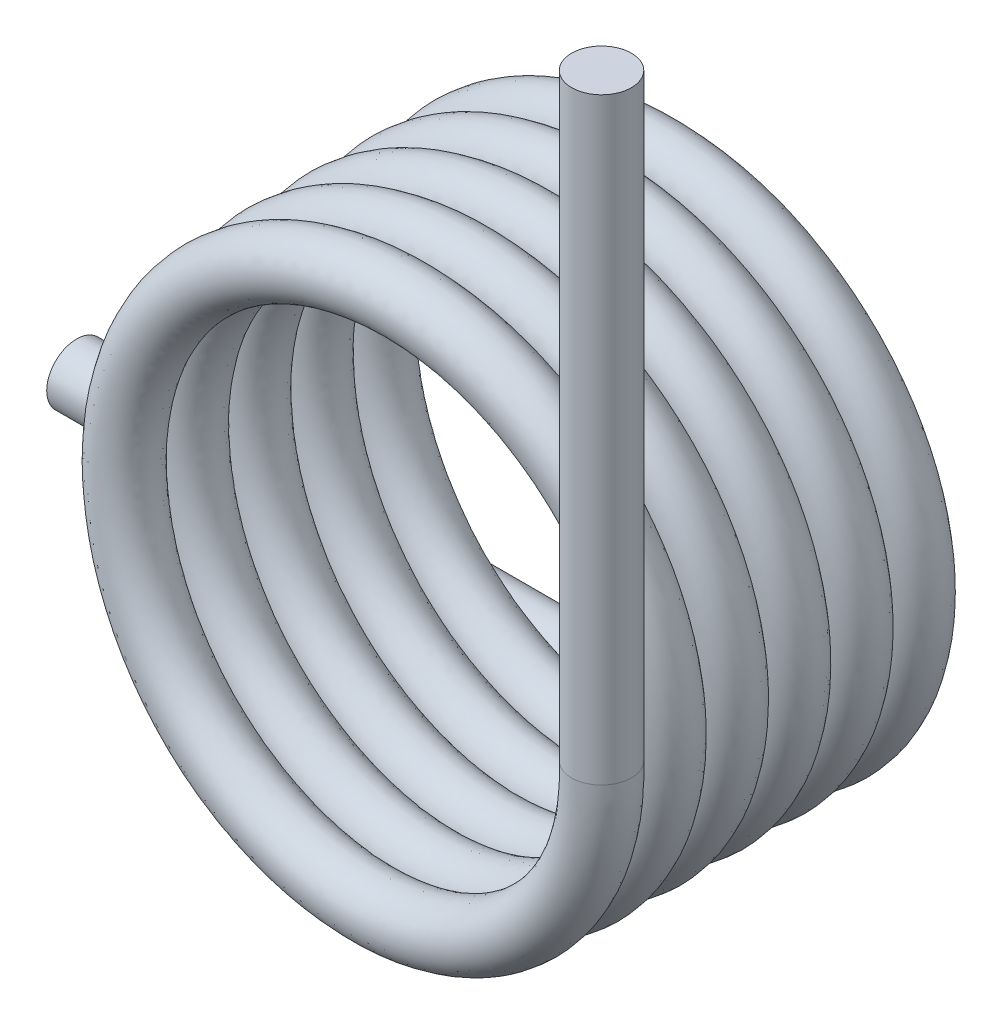
from build123d import *

# Parameters (mm, degrees)
SWEEP1_PITCH        = 0.625
SWEEP1_HEIGHT       = 3.28125
SWEEP1_RADIUS       = 2.55
SWEEP1_START_ANGLE  = 180
SKETCH2_R           = 0.3
SKETCH4_R           = 0.3
BOSS_EXTRUDE1_DEPTH = 6
SKETCH5_R           = 0.3
BOSS_EXTRUDE2_DEPTH = 6


with BuildPart() as part:
    # Sweep1: sweep along a helix
    with BuildLine() as sweep1_path:
        add(Helix(SWEEP1_PITCH, SWEEP1_HEIGHT, SWEEP1_RADIUS, center=(0, 0, 0), direction=(0, 0, -1), mode=Mode.PRIVATE).rotate(Axis((0, 0, 0), (0, 0, -1)), SWEEP1_START_ANGLE))
    # Sketch2 → Sweep1 (sweep)
    with BuildSketch(Plane(origin=(0, 0, 0), x_dir=(1, 0, 0), z_dir=(0, 1, 0))):
        with Locations((2.55, 0)):
            Circle(SKETCH2_R)
    sweep(path=sweep1_path.line, is_frenet=True)

    # Sketch4 → Boss-Extrude1 (add)
    with BuildSketch(Plane(origin=(0, 0, 0), x_dir=(0, -1, 0), z_dir=(-1, 0, 0))):
        with Locations(Location((2.55, -3.28125, 0), (0, 0, 90))):
            Circle(SKETCH4_R)
    extrude(amount=BOSS_EXTRUDE1_DEPTH)

    # Sketch5 → Boss-Extrude2 (add)
    with BuildSketch(Plane(origin=(0, 0, 0), x_dir=(1, 0, 0), z_dir=(0, 1, 0))):
        with Locations(Location((2.55, 0, 0), (0, 0, 270))):
            Circle(SKETCH5_R)
    extrude(amount=BOSS_EXTRUDE2_DEPTH)


solid = part.part
